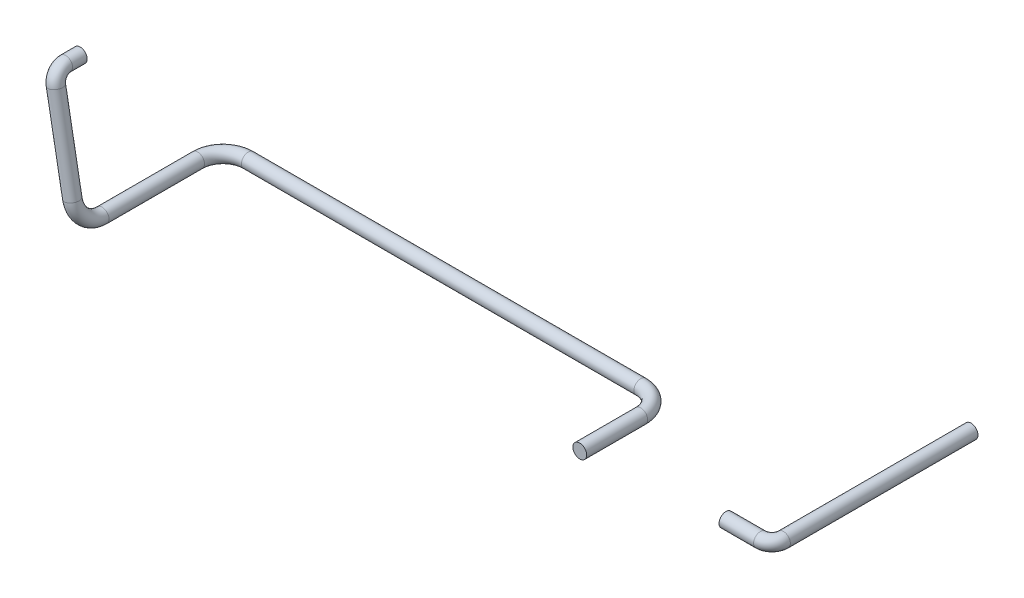
from build123d import *

# Parameters (mm, degrees)
PIPE_1_PROFILE_R = 6
PIPE_2_PROFILE_R = 6


with BuildPart() as part:
    # Pipe 1: sweep along a curve in space
    with BuildLine() as pipe_1_path:
        Line((285, 0, 344), (285, 0, 356.65))
        ThreePointArc((285, 0, 356.65), (285.542281334, -2.982547337, 363.968555185), (286.851464285, -10.18305357, 367))
        Line((286.851464285, -10.18305357, 367), (301.06452036, -88.354861978, 367))
        ThreePointArc((301.06452036, -88.354861978, 367), (303.847324701, -103.660285853, 360.556349186), (305, -110, 345))
        Line((305, -110, 345), (305, -110, 262))
        ThreePointArc((305, -110, 262), (311.443650814, -110, 246.443650814), (327, -110, 240))
        Line((327, -110, 240), (668, -110, 240))
        ThreePointArc((668, -110, 240), (683.556349186, -110, 246.443650814), (690, -110, 262))
        Line((690, -110, 262), (690, -110, 315))
    # Pipe 1 profile (on start of the path) → Pipe 1 (sweep)
    with BuildSketch(Plane(origin=(285, 0, 344), x_dir=(1, 0, 0), z_dir=(0, 0, 1))):
        Circle(PIPE_1_PROFILE_R)
    sweep(path=pipe_1_path.line)


with BuildPart() as body_2:
    # Pipe 2: sweep along a curve in space
    with BuildLine() as pipe_2_path:
        Line((855, -60, 353), (885, -60, 353))
        ThreePointArc((885, -60, 353), (892.071067812, -60, 350.071067812), (895, -60, 343))
        Line((895, -60, 343), (895, -60, 180))
    # Pipe 2 profile (on start of the path) → Pipe 2 (sweep)
    with BuildSketch(Plane(origin=(855, -60, 353), x_dir=(0, 0, 1), z_dir=(1, 0, 0))):
        Circle(PIPE_2_PROFILE_R)
    sweep(path=pipe_2_path.line)


solid = Compound([part.part, body_2.part])
